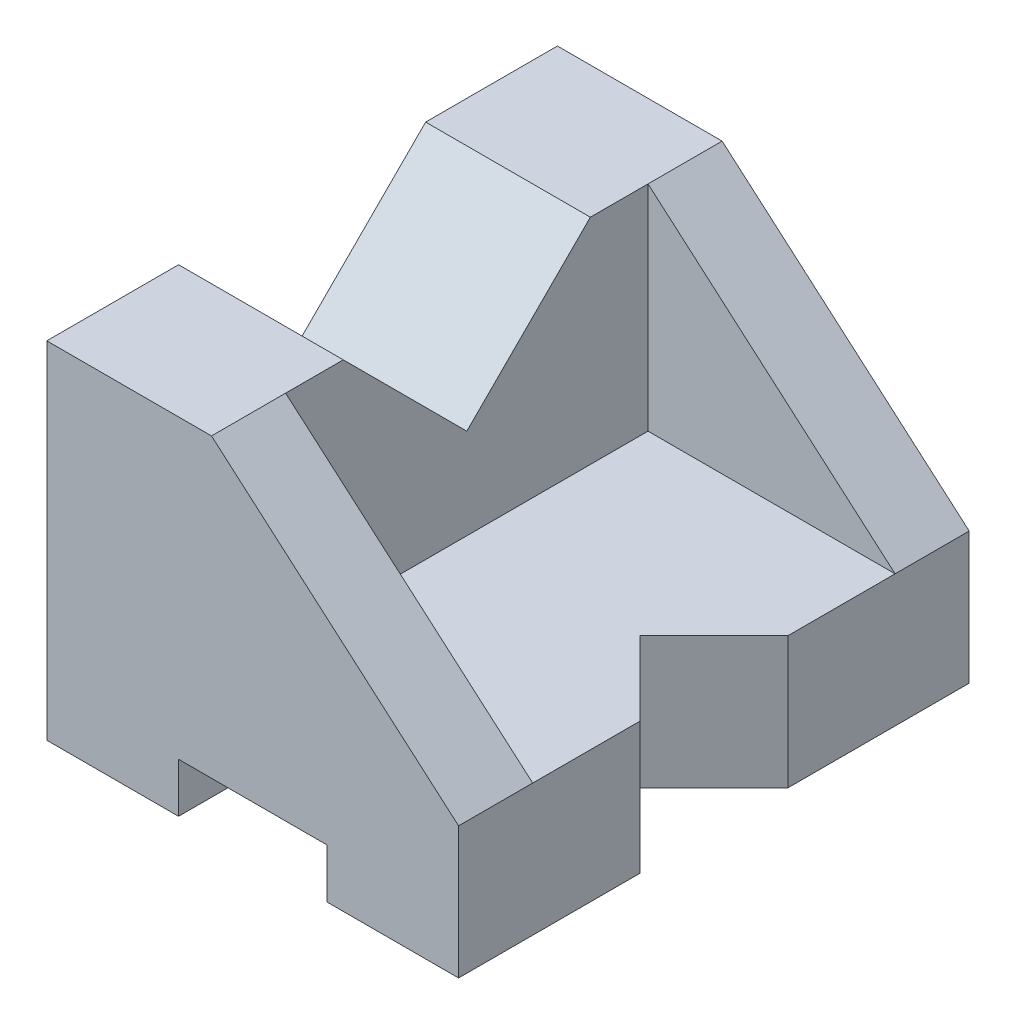
from build123d import *

# Parameters (mm, degrees)
BOSS_EXTRUDE1_DEPTH     = 31
BOSS_EXTRUDE2_START     = 22
BOSS_EXTRUDE2_DEPTH     = 9
BOSS_EXTRUDE3_START     = -22
BOSS_EXTRUDE3_DEPTH     = 9
CUT_EXTRUDE1_DEPTH      = 57.187187152
CUT_EXTRUDE1_DEPTH_BACK = 57.187187152
CUT_EXTRUDE2_DEPTH      = 48.560487802
CUT_EXTRUDE2_DEPTH_BACK = 48.560487802


with BuildPart() as part:
    # Sketch1 → Boss-Extrude1 (new, symmetric)
    with BuildSketch(Plane.XY):
        Polygon((-25, 36), (-25, -6), (-9, -6), (-9, 0), (9, 0), (9, -6), (25, -6), (25, 10), (-5, 10), (-5, 36), align=None)
    extrude(amount=BOSS_EXTRUDE1_DEPTH, both=True)

    # Sketch1<3> → Boss-Extrude2 (add)
    with BuildSketch(Plane.XY.offset(BOSS_EXTRUDE2_START)):
        Polygon((25, 10), (-5, 36), (-5, 10), align=None)
    extrude(amount=BOSS_EXTRUDE2_DEPTH)

    # Sketch1<4> → Boss-Extrude3 (add)
    with BuildSketch(Plane.XY.offset(BOSS_EXTRUDE3_START)):
        Polygon((25, 10), (-5, 36), (-5, 10), align=None)
    extrude(amount=-BOSS_EXTRUDE3_DEPTH)

    # Sketch2 → Cut-Extrude1 (cut, two sides: drawn at the far end of the back side and taken through both)
    with BuildSketch(Plane(origin=(-5, 0, 0), x_dir=(0, 0, -1), z_dir=(1, 0, 0)).offset(-CUT_EXTRUDE1_DEPTH_BACK)):
        Polygon((-110.161929994, 131.161929994), (-15, 36), (0, 21), (15, 36), (110.161929994, 131.161929994), (110.161929994, 400.320514032), (-110.161929994, 400.320514032), align=None)
    extrude(amount=CUT_EXTRUDE1_DEPTH + CUT_EXTRUDE1_DEPTH_BACK, mode=Mode.SUBTRACT)

    # Sketch3 → Cut-Extrude2 (cut, two sides: drawn at the far end of the back side and taken through both)
    with BuildSketch(Plane(origin=(0, 10, 0), x_dir=(1, 0, 0), z_dir=(0, 1, 0)).offset(-CUT_EXTRUDE2_DEPTH_BACK)):
        Polygon((122.624919193, 106.624919193), (25, 9), (16, 0), (25, -9), (122.624919193, -106.624919193), (398.749888691, -106.624919193), (398.749888691, 106.624919193), align=None)
    extrude(amount=CUT_EXTRUDE2_DEPTH + CUT_EXTRUDE2_DEPTH_BACK, mode=Mode.SUBTRACT)


solid = part.part
